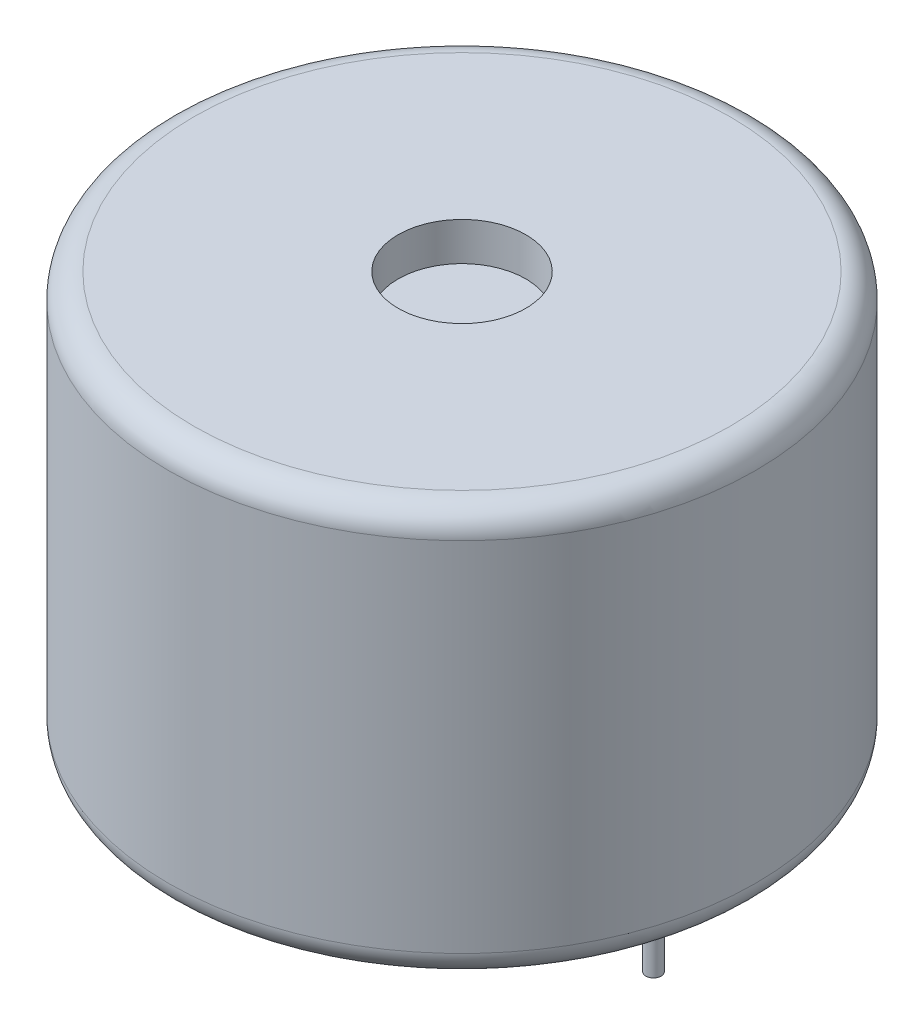
from build123d import *

# Parameters (mm, degrees)
SKETCH_1_R      = 11.5
EXTRUDE_1_DEPTH = 16
SKETCH_2_R      = 0.3
EXTRUDE_2_DEPTH = 4
FILLET_1_R      = 1


with BuildPart() as part:
    # 草图1 → 凸台-拉伸1 (new body)
    with BuildSketch(Plane(origin=(0, 0, 0), x_dir=(1, 0, 0), z_dir=(0, 1, 0))):
        with Locations(Location((0, 0, 0), (0, 0, 270))):
            Circle(SKETCH_1_R)
    extrude(amount=EXTRUDE_1_DEPTH)

    # 草图2 → 凸台-拉伸2 (add)
    with BuildSketch(Plane.XZ):
        with Locations(Location((-7.5, 0, 0), (0, 0, 90))):
            Circle(SKETCH_2_R)
        with Locations(Location((7.5, 0, 0), (0, 0, 90))):
            Circle(SKETCH_2_R)
    extrude(amount=EXTRUDE_2_DEPTH)

    # 草图3 → 切除-旋转1 (revolve, cut)
    with BuildSketch(Plane(origin=(0, 19, 0), x_dir=(1, 0, 0), z_dir=(0, 0, -1))):
        Polygon((0, 3), (-2.5, 3), (-2.5, 4.5), (-10, 4.5), (-10, 8), (0, 8), align=None)
    revolve(axis=Axis((0, 34.240243578, 0), (0, -1, 0)), mode=Mode.SUBTRACT)

    # 圆角1
    fillet_1_edges = [part.edges().sort_by_distance(p)[0] for p in [
        (0, 0, -11.5),
        (0, 16, -11.5),
    ]]
    fillet(fillet_1_edges, radius=FILLET_1_R)


solid = part.part
